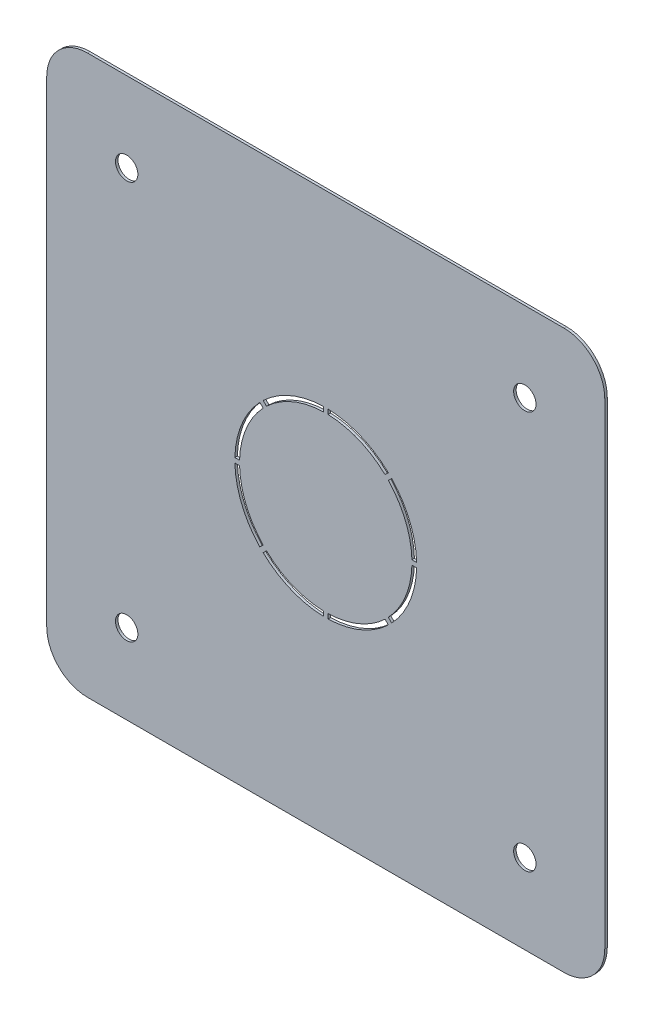
from build123d import *

# Parameters (mm, degrees)
SKETCH1_W           = 178
SKETCH1_H           = 178
SKETCH1_R           = 3.57
BOSS_EXTRUDE1_DEPTH = 0.8
FILLET1_R           = 13
CUT_EXTRUDE1_DEPTH  = 10


with BuildPart() as part:
    # Sketch1 → Boss-Extrude1 (new body)
    with BuildSketch(Plane.XY):
        with Locations((89, -89)):
            Rectangle(SKETCH1_W, SKETCH1_H)
        with Locations((25.5, -25.5)):
            Circle(SKETCH1_R, mode=Mode.SUBTRACT)
        with Locations((152.5, -25.5)):
            Circle(SKETCH1_R, mode=Mode.SUBTRACT)
        with Locations((152.5, -152.5)):
            Circle(SKETCH1_R, mode=Mode.SUBTRACT)
        with Locations((25.5, -152.5)):
            Circle(SKETCH1_R, mode=Mode.SUBTRACT)
    extrude(amount=BOSS_EXTRUDE1_DEPTH)

    # Fillet1
    fillet1_edges = [part.edges().sort_by_distance(p)[0] for p in [
        (0, 0, 0.4),
        (178, 0, 0.4),
        (178, -178, 0.4),
        (0, -178, 0.4),
    ]]
    fillet(fillet1_edges, radius=FILLET1_R)

    # Sketch2 → Cut-Extrude1 (cut)
    with BuildSketch(Plane.XY.offset(0.8)):
        with BuildLine():
            Line((88.25, -61.510229175), (88.25, -60.009699898))
            ThreePointArc((88.25, -60.009699898), (77.902180461, -62.207493557), (69.031092295, -67.970432123))
            Line((69.031092295, -67.970432123), (70.092126722, -69.031466551))
            ThreePointArc((70.092126722, -69.031466551), (78.47620561, -63.593312856), (88.25, -61.510229175))
        make_face()
        with BuildLine():
            ThreePointArc((108.968907705, -67.970432123), (100.097819539, -62.207493557), (89.75, -60.009699898))
            Line((89.75, -60.009699898), (89.75, -61.510229175))
            ThreePointArc((89.75, -61.510229175), (99.52379439, -63.593312856), (107.907873278, -69.031466551))
            Line((107.907873278, -69.031466551), (108.968907705, -67.970432123))
        make_face()
        with BuildLine():
            ThreePointArc((117.990300102, -88.25), (115.792506443, -77.902180461), (110.029567877, -69.031092295))
            Line((110.029567877, -69.031092295), (108.968533449, -70.092126722))
            ThreePointArc((108.968533449, -70.092126722), (114.406687144, -78.47620561), (116.489770825, -88.25))
            Line((116.489770825, -88.25), (117.990300102, -88.25))
        make_face()
        with BuildLine():
            ThreePointArc((89.75, -117.990300102), (100.097819539, -115.792506443), (108.968907705, -110.029567877))
            Line((108.968907705, -110.029567877), (107.907873278, -108.968533449))
            ThreePointArc((107.907873278, -108.968533449), (99.52379439, -114.406687144), (89.75, -116.489770825))
            Line((89.75, -116.489770825), (89.75, -117.990300102))
        make_face()
        with BuildLine():
            ThreePointArc((110.029567877, -108.968907705), (115.792506443, -100.097819539), (117.990300102, -89.75))
            Line((117.990300102, -89.75), (116.489770825, -89.75))
            ThreePointArc((116.489770825, -89.75), (114.406687144, -99.52379439), (108.968533449, -107.907873278))
            Line((108.968533449, -107.907873278), (110.029567877, -108.968907705))
        make_face()
        with BuildLine():
            Line((69.031466551, -70.092126722), (67.970432123, -69.031092295))
            ThreePointArc((67.970432123, -69.031092295), (62.207493557, -77.902180461), (60.009699898, -88.25))
            Line((60.009699898, -88.25), (61.510229175, -88.25))
            ThreePointArc((61.510229175, -88.25), (63.593312856, -78.47620561), (69.031466551, -70.092126722))
        make_face()
        with BuildLine():
            Line((61.510229175, -89.75), (60.009699898, -89.75))
            ThreePointArc((60.009699898, -89.75), (62.207493557, -100.097819539), (67.970432123, -108.968907705))
            Line((67.970432123, -108.968907705), (69.031466551, -107.907873278))
            ThreePointArc((69.031466551, -107.907873278), (63.593312856, -99.52379439), (61.510229175, -89.75))
        make_face()
        with BuildLine():
            Line((70.092126722, -108.968533449), (69.031092295, -110.029567877))
            ThreePointArc((69.031092295, -110.029567877), (77.902180461, -115.792506443), (88.25, -117.990300102))
            Line((88.25, -117.990300102), (88.25, -116.489770825))
            ThreePointArc((88.25, -116.489770825), (78.47620561, -114.406687144), (70.092126722, -108.968533449))
        make_face()
    extrude(amount=-CUT_EXTRUDE1_DEPTH, mode=Mode.SUBTRACT)


solid = part.part
